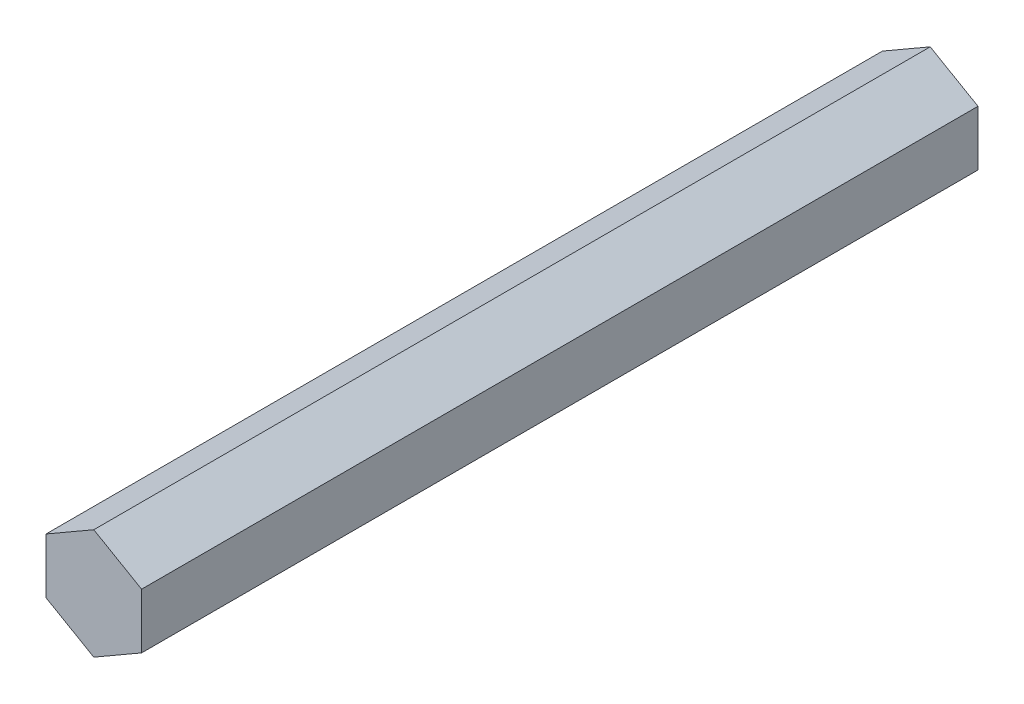
from build123d import *

# Parameters (mm, degrees)
BOSS_EXTRUDE1_DEPTH = 55.5625


with BuildPart() as part:
    # Sketch3 → Boss-Extrude1 (new, symmetric)
    with BuildSketch(Plane.XY):
        Polygon((0, 7.332348419), (6.35, 3.666174209), (6.35, -3.666174209), (0, -7.332348419), (-6.35, -3.666174209), (-6.35, 3.666174209), align=None)
    extrude(amount=BOSS_EXTRUDE1_DEPTH, both=True)


solid = part.part
